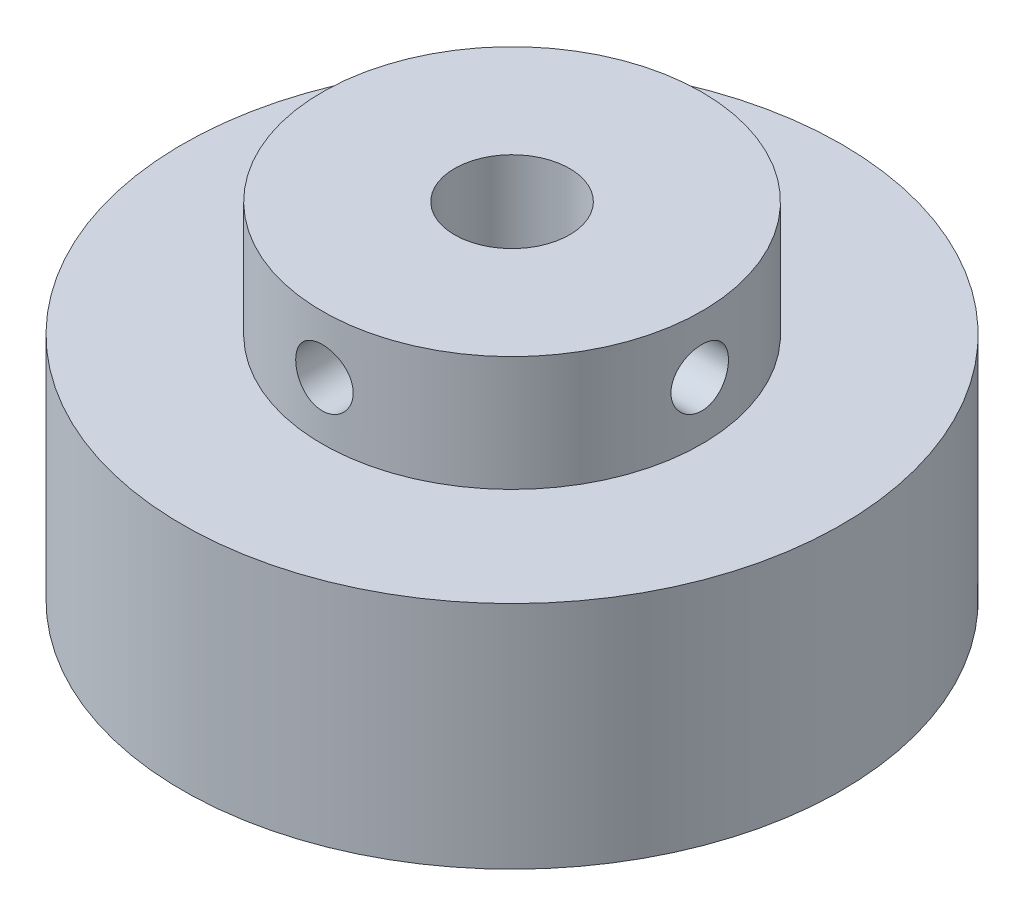
from build123d import *

# Parameters (mm, degrees)
CROQUIS3_R            = 5
CORTAR_EXTRUIR1_DEPTH = 51.41472999
MATRIZC1_COUNT        = 2
MATRIZC1_ANGLE        = 90


with BuildPart() as part:
    # Croquis1 → Revolución1 (revolve)
    with BuildSketch(Plane.XY, mode=Mode.PRIVATE) as revoluci_n1_sk:
        Polygon((-4, 0), (-4, 30), (-16.5, 30), (-16.5, 20), (-28.65, 20), (-28.65, 0), align=None)
    revolve(revoluci_n1_sk.sketch.rotate(Axis((0, 0, 0), (0, 1, 0)), 270), axis=Axis((0, 0, 0), (0, 1, 0)))

    # Croquis3 → Cortar-Extruir1 (cut, through all)
    with BuildSketch(Plane(origin=(0, 30, 0), x_dir=(1, 0, 0), z_dir=(0, 1, 0))):
        with Locations(Location((0, 0, 0), (0, 0, 270))):
            Circle(CROQUIS3_R)
    extrude(amount=-CORTAR_EXTRUIR1_DEPTH, mode=Mode.SUBTRACT)

    # Croquis6 → Taladro roscado M6x1.01 (revolve, cut)
    with BuildSketch(Plane(origin=(16.5, 25, 0), x_dir=(0, 0, -1), z_dir=(0, 1, 0))):
        Polygon((0, 0), (0, 18.502151548), (2.5, 17), (2.5, 0), align=None)
    taladro_roscado_m6x1_01 = revolve(axis=Axis((22.85, 25, 0), (-1, 0, 0)), mode=Mode.SUBTRACT)

    # MatrizC1: Taladro roscado M6x1.01 ×2 about axis
    matrizc1_axis = Axis((0, 30, 0), (0, -1, 0))
    for i in range(1, MATRIZC1_COUNT):
        add(taladro_roscado_m6x1_01.rotate(matrizc1_axis, i * MATRIZC1_ANGLE / (MATRIZC1_COUNT - 1)), mode=Mode.SUBTRACT)


solid = part.part
